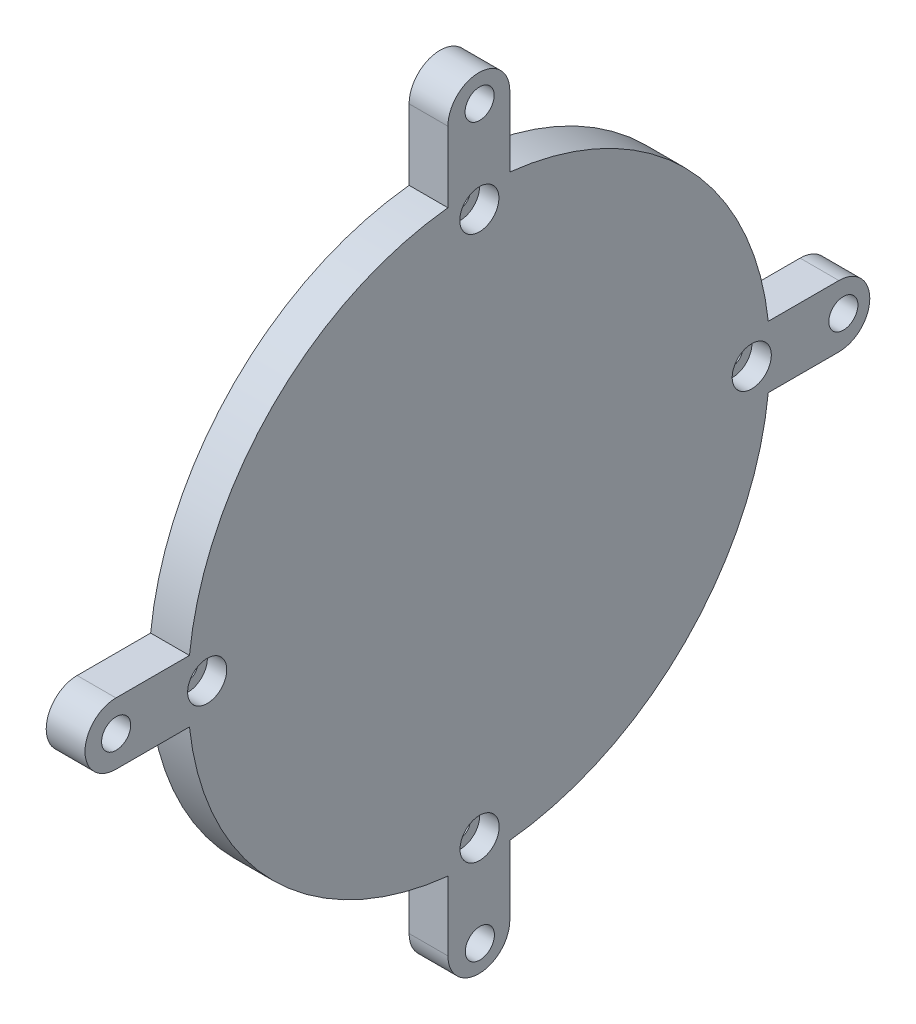
from build123d import *

# Parameters (mm, degrees)
SKETCH1_R           = 75
BOSS_EXTRUDE1_DEPTH = 10
BOSS_EXTRUDE2_DEPTH = 10
SKETCH3_R           = 2.5
SKETCH3_R_2         = 3.75
CUT_EXTRUDE1_DEPTH  = 144.351459106
CIRPATTERN1_COUNT   = 4
CUT_EXTRUDE2_START  = -5
SKETCH4_R           = 5.043629395
CUT_EXTRUDE2_DEPTH  = 149.351459106
CIRPATTERN2_COUNT   = 4


with BuildPart() as part:
    # Sketch1 → Boss-Extrude1 (new body)
    with BuildSketch(Plane.YZ):
        with Locations(Location((0, 0, 0), (0, 0, 270))):
            Circle(SKETCH1_R)
    extrude(amount=BOSS_EXTRUDE1_DEPTH)

    # Sketch2 → Boss-Extrude2 (add)
    with BuildSketch(Plane(origin=(0, 0, 0), x_dir=(0, -1, 0), z_dir=(-1, 0, 0))):
        with BuildLine():
            Line((-92.771012238, 7.974028306), (92.382035247, 7.974028306))
            ThreePointArc((92.382035247, 7.974028306), (100.356063553, 0), (92.382035247, -7.974028306))
            Line((92.382035247, -7.974028306), (-92.771012238, -7.974028306))
            ThreePointArc((-92.771012238, -7.974028306), (-100.745040543, 0), (-92.771012238, 7.974028306))
        make_face()
        with BuildLine():
            Line((-7.968256638, -92.769682141), (-7.968256638, 93.521041486))
            ThreePointArc((-7.968256638, 93.521041486), (0, 101.489298124), (7.968256638, 93.521041486))
            Line((7.968256638, 93.521041486), (7.968256638, -92.769682141))
            ThreePointArc((7.968256638, -92.769682141), (0, -100.73793878), (-7.968256638, -92.769682141))
        make_face()
    extrude(amount=-BOSS_EXTRUDE2_DEPTH)

    # Sketch3 → Cut-Extrude1 (cut, symmetric)
    with BuildSketch(Plane.YZ.offset(10)):
        with Locations(Location((0, 70, 0), (0, 0, 270))):
            Circle(SKETCH3_R)
        with Locations(Location((0, 93.46793349, 0), (0, 0, 270))):
            Circle(SKETCH3_R_2)
    cut_extrude1 = extrude(amount=CUT_EXTRUDE1_DEPTH, both=True, mode=Mode.SUBTRACT)

    # CirPattern1: Cut-Extrude1 ×4 about axis
    cirpattern1_axis = Axis((0, 0.032009754, -0.225189286), (1, 0, 0))
    for i in range(1, CIRPATTERN1_COUNT):
        add(cut_extrude1.rotate(cirpattern1_axis, i * 360 / CIRPATTERN1_COUNT), mode=Mode.SUBTRACT)

    # Sketch4 → Cut-Extrude2 (cut)
    with BuildSketch(Plane.YZ.offset(10).offset(CUT_EXTRUDE2_START)):
        with Locations(Location((0, 70, 0), (0, 0, 90))):
            Circle(SKETCH4_R)
    cut_extrude2 = extrude(amount=CUT_EXTRUDE2_DEPTH, mode=Mode.SUBTRACT)

    # CirPattern2: Cut-Extrude2 ×4 about axis
    cirpattern2_axis = Axis((0, 0.032003773, -0.157220476), (1, 0, 0))
    for i in range(1, CIRPATTERN2_COUNT):
        add(cut_extrude2.rotate(cirpattern2_axis, i * 360 / CIRPATTERN2_COUNT), mode=Mode.SUBTRACT)


solid = part.part
